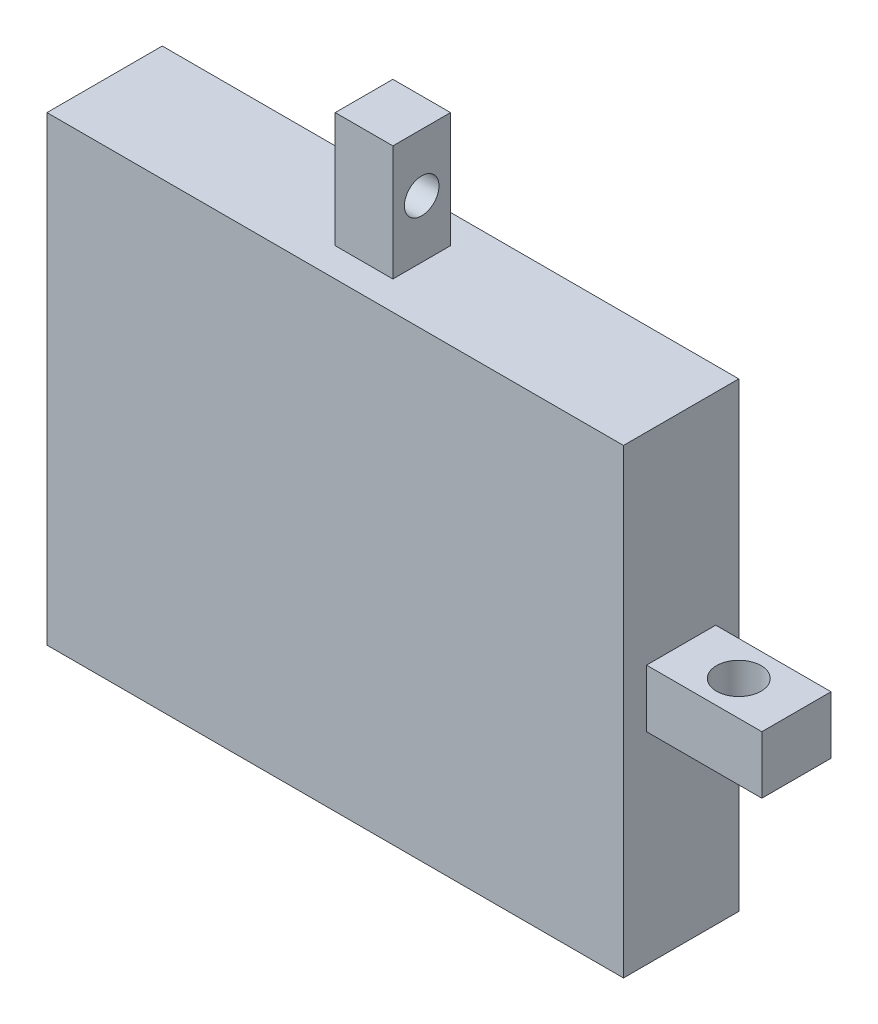
from build123d import *

# Parameters (mm, degrees)
SKETCH1_W           = 50
SKETCH1_H           = 40
BOSS_EXTRUDE1_DEPTH = 10
SKETCH5_W           = 6
SKETCH5_H           = 5
BOSS_EXTRUDE3_DEPTH = 10
SKETCH6_R           = 2
CUT_EXTRUDE1_DEPTH  = 20
SKETCH8_W           = 10
SKETCH8_H           = 40
CUT_EXTRUDE2_DEPTH  = 25
SKETCH9_W           = 10
SKETCH9_H           = 6
SKETCH9_R           = 1.930897171
BOSS_EXTRUDE4_DEPTH = 5
SKETCH10_W          = 10
SKETCH10_H          = 5
CUT_EXTRUDE3_DEPTH  = 15
SKETCH11_W          = 5
SKETCH11_H          = 5
BOSS_EXTRUDE5_DEPTH = 10
SKETCH12_R          = 1.5
CUT_EXTRUDE4_DEPTH  = 10


with BuildPart() as part:
    # Sketch1 → Boss-Extrude1 (new body)
    with BuildSketch(Plane(origin=(669.84184187, 0, 0), x_dir=(1, 0, 0), z_dir=(0, 0, 1))):
        with Locations((-671.310344828, 437.637931034)):
            Rectangle(SKETCH1_W, SKETCH1_H)
    boss_extrude1 = extrude(amount=BOSS_EXTRUDE1_DEPTH)

    # Sketch5 → Boss-Extrude3 (add)
    with BuildSketch(Plane(origin=(23.531497042, 0, 0), x_dir=(0, 0, -1), z_dir=(1, 0, 0))):
        with Locations((-5, 442.637931034)):
            Rectangle(SKETCH5_W, SKETCH5_H)
        with Locations((-5, 432.637931034)):
            Rectangle(SKETCH5_W, SKETCH5_H)
    extrude(amount=BOSS_EXTRUDE3_DEPTH)

    # Sketch6 → Cut-Extrude1 (cut)
    with BuildSketch(Plane(origin=(669.84184187, 445.137931034, 0), x_dir=(1, 0, 0), z_dir=(0, 1, 0))):
        with Locations(Location((-641.310344828, -5, 0), (0, 0, 180))):
            Circle(SKETCH6_R)
    extrude(amount=-CUT_EXTRUDE1_DEPTH, mode=Mode.SUBTRACT)

    # Sketch8 → Cut-Extrude2 (cut)
    with BuildSketch(Plane.ZY.offset(26.468502958)):
        with Locations((5, 437.637931034)):
            Rectangle(SKETCH8_W, SKETCH8_H)
    extrude(amount=-CUT_EXTRUDE2_DEPTH, mode=Mode.SUBTRACT)

    # Sketch9 → Boss-Extrude4 (add)
    with BuildSketch(Plane(origin=(0, 435.137931034, 0), x_dir=(1, 0, 0), z_dir=(0, 1, 0))):
        with Locations((28.531497042, -5)):
            Rectangle(SKETCH9_W, SKETCH9_H)
        with Locations(Location((28.531497042, -5, 0), (0, 0, 180))):
            Circle(SKETCH9_R, mode=Mode.SUBTRACT)
    extrude(amount=BOSS_EXTRUDE4_DEPTH)

    # Sketch10 → Cut-Extrude3 (cut)
    with BuildSketch(Plane.XY.offset(8)):
        with Locations((28.531497042, 432.637931034)):
            Rectangle(SKETCH10_W, SKETCH10_H)
        with Locations((28.531497042, 442.637931034)):
            Rectangle(SKETCH10_W, SKETCH10_H)
    extrude(amount=-CUT_EXTRUDE3_DEPTH, mode=Mode.SUBTRACT)

    # Mirror1: Boss-Extrude1 across plane
    add(boss_extrude1.mirror(Plane(origin=(-1.468502958, 0, 0), x_dir=(0, 0, 1), z_dir=(1, 0, 0))))

    # Sketch11 → Boss-Extrude5 (add)
    with BuildSketch(Plane(origin=(0, 457.637931034, 0), x_dir=(1, 0, 0), z_dir=(0, 1, 0))):
        with Locations((-1.468502958, -5)):
            Rectangle(SKETCH11_W, SKETCH11_H)
    extrude(amount=BOSS_EXTRUDE5_DEPTH)

    # Sketch12 → Cut-Extrude4 (cut)
    with BuildSketch(Plane(origin=(1.031497042, 0, 0), x_dir=(0, 0, -1), z_dir=(1, 0, 0))):
        with Locations((-5, 462.637931034)):
            Circle(SKETCH12_R)
    extrude(amount=-CUT_EXTRUDE4_DEPTH, mode=Mode.SUBTRACT)


solid = part.part
